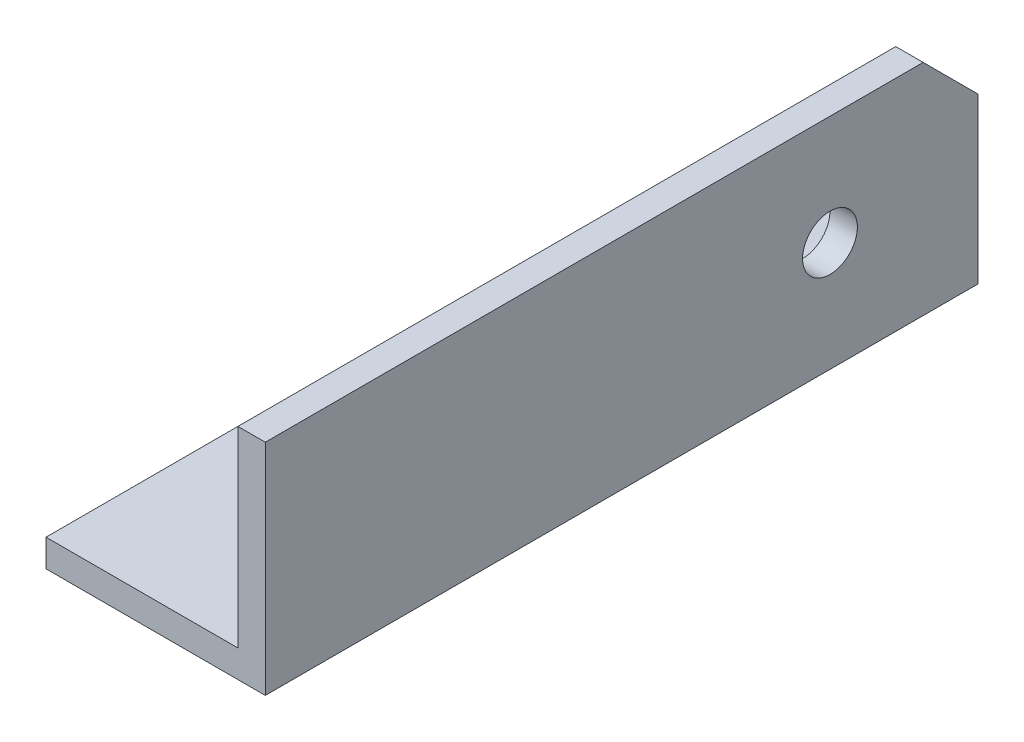
from build123d import *

# Parameters (mm, degrees)
EXTRUDE_THIN1_DEPTH      = 65
EXTRUDE_THIN1_DEPTH_BACK = 65
CHAMFER1_SIZE            = 10
SKETCH3_R                = 5
CUT_EXTRUDE1_DEPTH       = 10


with BuildPart() as part:
    # Sketch2 → Extrude-Thin1 (new, two sides: drawn at the far end of the back side and taken through both)
    with BuildSketch(Plane.XY.offset(-EXTRUDE_THIN1_DEPTH_BACK)):
        Polygon((-40, 0), (0, 0), (0, 40), (-5, 40), (-5, 5), (-40, 5), align=None)
    extrude(amount=EXTRUDE_THIN1_DEPTH + EXTRUDE_THIN1_DEPTH_BACK)

    # Chamfer1
    chamfer1_edges = [part.edges().sort_by_distance(p)[0] for p in [
        (-40, 2.5, -65),
        (-2.5, 40, -65),
    ]]
    chamfer(chamfer1_edges, length=CHAMFER1_SIZE)

    # Sketch3 → Cut-Extrude1 (cut)
    with BuildSketch(Plane.ZY.offset(5)):
        with Locations((-38, 20)):
            Circle(SKETCH3_R)
    extrude(amount=-CUT_EXTRUDE1_DEPTH, mode=Mode.SUBTRACT)


solid = part.part
